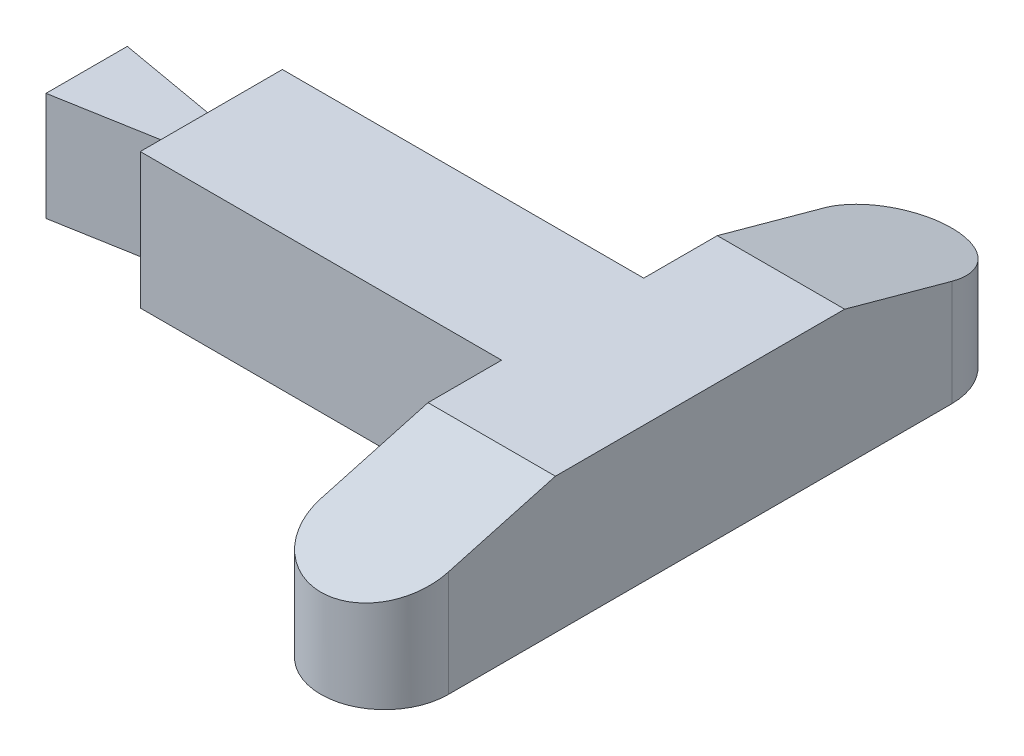
from build123d import *

# Parameters (mm, degrees)
BOSS_EXTRUDE1_DEPTH     = 38.1
CUT_EXTRUDE_THIN5_DEPTH = 35.814
CUT_EXTRUDE9_DEPTH      = 198.640484432
CUT_EXTRUDE9_DEPTH_BACK = 35.814
CUT_EXTRUDE10_DEPTH     = 7.62


with BuildPart() as part:
    # Sketch1 → Boss-Extrude1 (new body)
    with BuildSketch(Plane(origin=(0, 0, 0), x_dir=(1, 0, 0), z_dir=(0, 1, 0))):
        with BuildLine():
            Line((0, 11.43), (0, -11.43))
            Line((0, -11.43), (35.052, -5.249386672))
            Line((35.052, -5.249386672), (35.052, -19.981386672))
            Line((35.052, -19.981386672), (136.652, -19.981386672))
            Line((136.652, -19.981386672), (136.652, -70.781386672))
            ThreePointArc((136.652, -70.781386672), (154.559, -88.688386672), (172.466, -70.781386672))
            Line((172.466, -70.781386672), (172.466, 70.781386672))
            ThreePointArc((172.466, 70.781386672), (154.559, 88.688386672), (136.652, 70.781386672))
            Line((136.652, 70.781386672), (136.652, 19.981386672))
            Line((136.652, 19.981386672), (35.052, 19.981386672))
            Line((35.052, 19.981386672), (35.052, 5.249386672))
            Line((35.052, 5.249386672), (0, 11.43))
        make_face()
    extrude(amount=BOSS_EXTRUDE1_DEPTH)

    # Sketch3 → Cut-Extrude-Thin5 (cut)
    with BuildSketch(Plane(origin=(172.466, 0, 0), x_dir=(0, 0, -1), z_dir=(1, 0, 0))):
        Polygon((-40.668819045, 38.1), (-88.688386672, 24.903727481), (-102.149697549, 73.887736193), (-54.130129922, 87.084008712), align=None)
    extrude(amount=-CUT_EXTRUDE_THIN5_DEPTH, mode=Mode.SUBTRACT)

    # Sketch4 → Cut-Extrude9 (cut, two sides: drawn at the far end of the back side and taken through both)
    with BuildSketch(Plane(origin=(172.466, 0, 0), x_dir=(0, 0, -1), z_dir=(1, 0, 0)).offset(-CUT_EXTRUDE9_DEPTH_BACK)):
        Polygon((-314.400611186, 135.676742064), (40.668819045, 38.1), (88.688386672, 24.903727481), (443.757816904, -72.673014582), (638.911301031, 637.465845881), (-119.247127059, 845.815602527), align=None)
    extrude(amount=CUT_EXTRUDE9_DEPTH + CUT_EXTRUDE9_DEPTH_BACK, mode=Mode.SUBTRACT)

    # Sketch5 → Cut-Extrude10 (cut)
    with BuildSketch(Plane(origin=(0, 38.1, 0), x_dir=(1, 0, 0), z_dir=(0, 1, 0))):
        Polygon((0, -11.43), (0, 11.43), (0.210478784, 11.603037745), (35.052, 5.249386672), (35.052, -5.249386672), align=None)
    extrude(amount=-CUT_EXTRUDE10_DEPTH, mode=Mode.SUBTRACT)


solid = part.part
